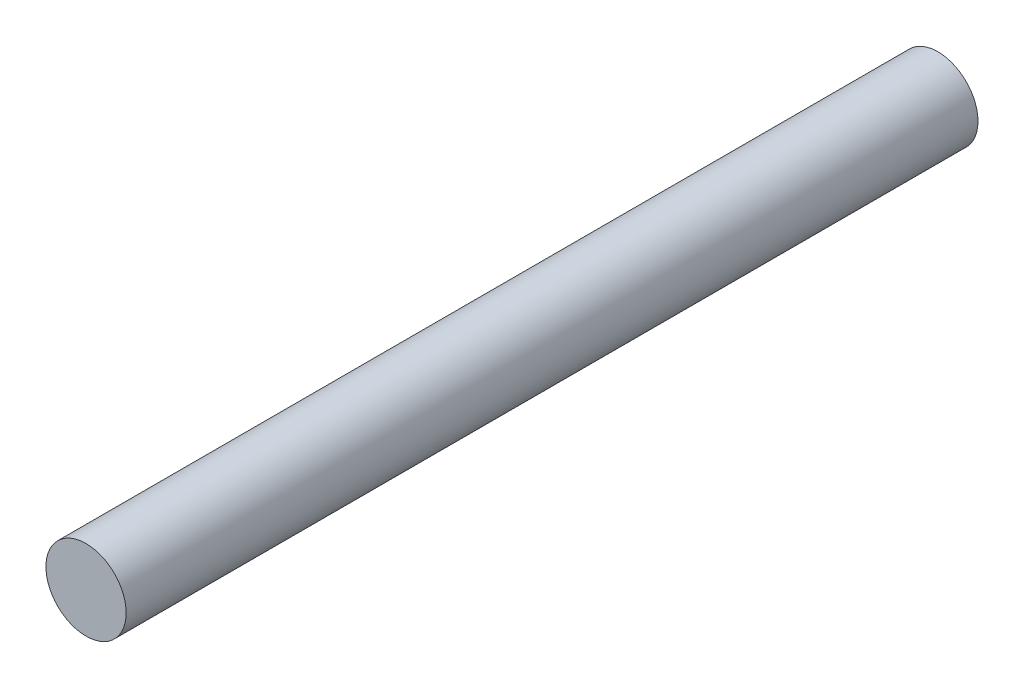
from build123d import *

# Parameters (mm, degrees)
SKETCH1_R           = 4.05
BOSS_EXTRUDE1_DEPTH = 86


with BuildPart() as part:
    # Sketch1 → Boss-Extrude1 (new body)
    with BuildSketch(Plane.XY):
        Circle(SKETCH1_R)
    extrude(amount=BOSS_EXTRUDE1_DEPTH)


solid = part.part
